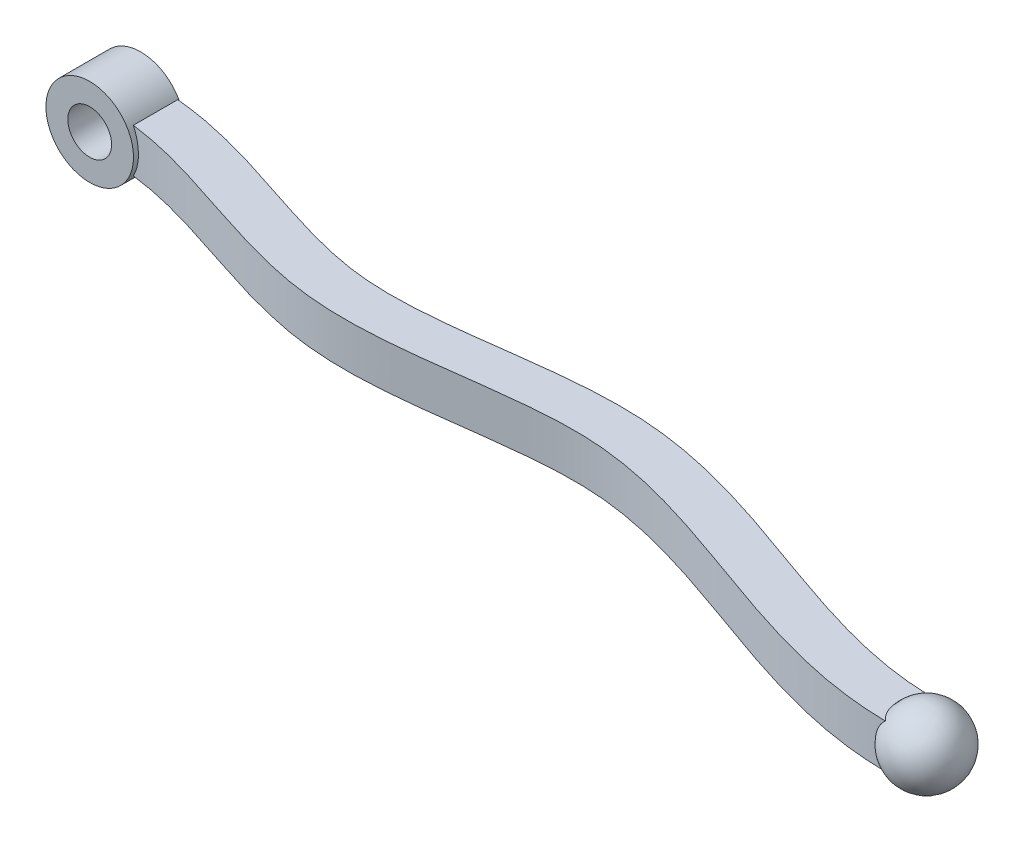
from build123d import *

# Parameters (mm, degrees)
BOSS_EXTRUDE1_DEPTH = 15
SKETCH5_R           = 30
BOSS_EXTRUDE4_DEPTH = 35
SKETCH6_R           = 15
CUT_EXTRUDE2_DEPTH  = 658.158631648


with BuildPart() as part:
    # Sketch1 → Boss-Extrude1 (new, symmetric)
    with BuildSketch(Plane(origin=(0, 0, 0), x_dir=(1, 0, 0), z_dir=(0, 1, 0))):
        with BuildLine():
            Line((0, -5), (0, -20))
            Line((0, -20), (0, -35))
            add(Edge.make_bspline(
                [(0, -35), (6.175174361, -34.731974318), (18.515259067, -35.012962052), (37.170665591, -37.515936577), (56.084854153, -41.725868316), (81.712849626, -49.053730026), (108.020452627, -58.038993525), (135.256646497, -66.61683525), (156.260387173, -72.27435683), (174.30161309, -75.842819676), (189.165827888, -77.673526433), (203.993330922, -78.725985533), (222.371445803, -78.796796897), (251.387993429, -76.975410397), (286.850532323, -72.387550501), (321.010389509, -67.88841281), (347.295858139, -66.038023205), (363.238954324, -65.921251546), (375.651284697, -66.633730128), (388.109822122, -67.909306152), (403.749690688, -70.472302604), (422.682260499, -74.876939258), (448.174732674, -82.194518923), (480.555456963, -93.408377778), (520.427662962, -107.943611619), (554.767112987, -118.972911004), (583.11571196, -125.872568026), (604.860049285, -129.743358512), (623.423539204, -131.586992844), (638.512385714, -132.052047053), (646.184378033, -131.915612276), (650, -131.75)],
                knots=[0, 0, 0, 0, 0.03125, 0.0625, 0.09375, 0.125, 0.1875, 0.21875, 0.25, 0.28125, 0.296875, 0.3125, 0.34375, 0.375, 0.4375, 0.5, 0.53125, 0.5625, 0.578125, 0.59375, 0.625, 0.65625, 0.6875, 0.75, 0.8125, 0.875, 0.90625, 0.9375, 0.96875, 0.984375, 1, 1, 1, 1], degree=3))
            Line((650, -131.75), (650, -101.645600987))
            add(Edge.make_bspline(
                [(0, -5), (1.96121961, -4.914566966), (5.89915893, -4.808235128), (13.678199712, -4.84661064), (23.288809738, -5.335629693), (34.612129361, -6.543007958), (49.440406691, -8.865821345), (67.480970383, -12.895296736), (88.424967615, -18.894482835), (108.7643831, -25.466893146), (128.584292056, -32.05786323), (147.949320173, -38.143880852), (166.889863567, -43.230886953), (182.374300973, -46.26926705), (194.545455669, -47.765130055), (206.908721638, -48.6449899), (222.771634237, -48.71719013), (248.949227637, -47.087688283), (282.993579374, -42.71354585), (318.359716958, -38.016947817), (347.305595948, -35.957642702), (365.637654212, -35.802931958), (380.445806559, -36.649266306), (395.071873906, -38.147898415), (413.061689707, -41.102259412), (434.195904051, -46.025365016), (461.84064495, -53.966403244), (495.533336136, -65.651754599), (534.986656329, -80.020885253), (573.746471613, -92.423262495), (611.961966661, -100.702697659), (637.304908079, -102.198614128), (650, -101.645600987)],
                knots=[0, 0, 0, 0, 0.0078125, 0.015625, 0.03125, 0.046875, 0.0625, 0.09375, 0.125, 0.15625, 0.1875, 0.21875, 0.25, 0.28125, 0.296875, 0.3125, 0.34375, 0.375, 0.4375, 0.5, 0.53125, 0.5625, 0.578125, 0.59375, 0.625, 0.65625, 0.6875, 0.75, 0.8125, 0.875, 0.9375, 1, 1, 1, 1], degree=3))
        make_face()
    extrude(amount=BOSS_EXTRUDE1_DEPTH, both=True)

    # Sketch5 → Boss-Extrude4 (add)
    with BuildSketch(Plane.XY.offset(5)):
        Circle(SKETCH5_R)
    extrude(amount=BOSS_EXTRUDE4_DEPTH)

    # Sketch6 → Cut-Extrude2 (cut, through all)
    with BuildSketch(Plane.XY.offset(40)):
        Circle(SKETCH6_R)
    extrude(amount=-CUT_EXTRUDE2_DEPTH, mode=Mode.SUBTRACT)

    # Sketch8 → Revolve2 (revolve)
    with BuildSketch(Plane(origin=(0, 0, 0), x_dir=(1, 0, 0), z_dir=(0, 1, 0))):
        with BuildLine():
            Line((650, -91.697800493), (650, -141.697800493))
            ThreePointArc((650, -141.697800493), (675, -116.697800493), (650, -91.697800493))
        make_face()
    revolve(axis=Axis((650, 0, 91.697800493), (0, 0, 1)))


solid = part.part
